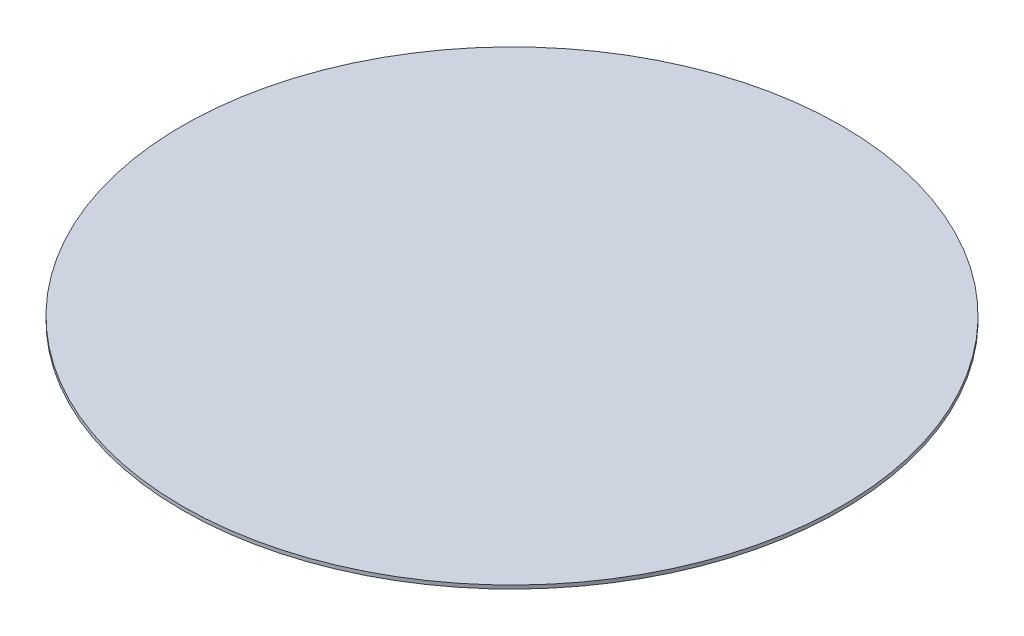
from build123d import *

# Parameters (mm, degrees)
SKETCH1_R           = 150
BOSS_EXTRUDE1_DEPTH = 1.6


with BuildPart() as part:
    # Sketch1 → Boss-Extrude1 (new body)
    with BuildSketch(Plane(origin=(0, 0, 0), x_dir=(1, 0, 0), z_dir=(0, 1, 0))):
        with Locations(Location((0, 0, 0), (0, 0, 270))):
            Circle(SKETCH1_R)
    extrude(amount=BOSS_EXTRUDE1_DEPTH)


solid = part.part
